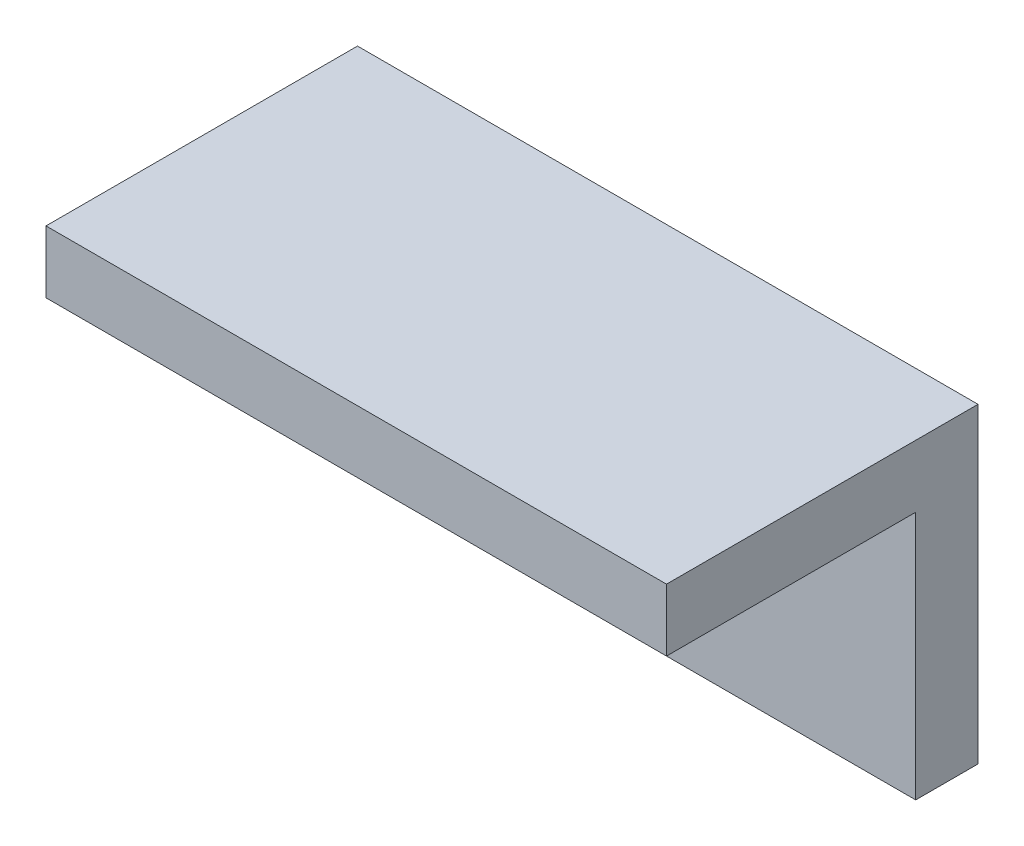
from build123d import *

# Parameters (mm, degrees)
BOSS_EXTRUDE1_DEPTH = 31.623


with BuildPart() as part:
    # Sketch1 → Boss-Extrude1 (new body)
    with BuildSketch(Plane(origin=(0, 0, 0), x_dir=(0, 0, -1), z_dir=(1, 0, 0))):
        Polygon((0, 0), (0, 15.875), (-15.875, 15.875), (-15.875, 12.7), (-3.175, 12.7), (-3.175, 0), align=None)
    extrude(amount=BOSS_EXTRUDE1_DEPTH)


solid = part.part
